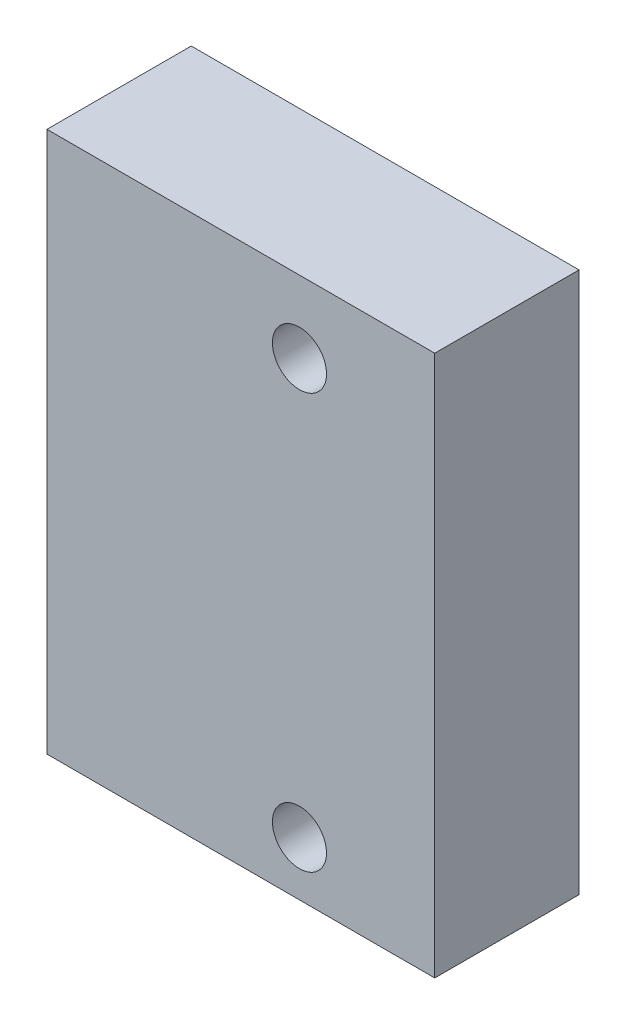
from build123d import *

# Parameters (mm, degrees)
SKETCH_1_W             = 43
SKETCH_1_H             = 60
EXTRUDE_3_DEPTH        = 16
SKETCH_2_R             = 3
CUT_EXTRUDE_1_DEPTH    = 76.531450403
HOLE_WIZARD_M6_1_D     = 5
HOLE_WIZARD_M6_1_DEPTH = 10
HOLE_WIZARD_M6_1_TIP   = 1.502151548


with BuildPart() as part:
    # 草图1 → 凸台-拉伸3 (new body)
    with BuildSketch(Plane.XY):
        with Locations((-21.5, 30)):
            Rectangle(SKETCH_1_W, SKETCH_1_H)
    extrude(amount=EXTRUDE_3_DEPTH)

    # 草图2 → 切除-拉伸1 (cut, through all)
    with BuildSketch(Plane(origin=(0, 0, 0), x_dir=(-1, 0, 0), z_dir=(0, 0, -1))):
        with Locations((15, 52)):
            Circle(SKETCH_2_R)
        with Locations((15, 6)):
            Circle(SKETCH_2_R)
    extrude(amount=-CUT_EXTRUDE_1_DEPTH, mode=Mode.SUBTRACT)

    # M6 螺纹孔1
    with Locations(Plane.ZY.offset(43)):
        with Locations((8, 42), (8, 18)):
            Hole(HOLE_WIZARD_M6_1_D / 2, depth=HOLE_WIZARD_M6_1_DEPTH)
            with Locations((0, 0, -(HOLE_WIZARD_M6_1_DEPTH + HOLE_WIZARD_M6_1_TIP / 2))):  # 118° drill point
                Cone(0, HOLE_WIZARD_M6_1_D / 2, HOLE_WIZARD_M6_1_TIP, mode=Mode.SUBTRACT)


solid = part.part
